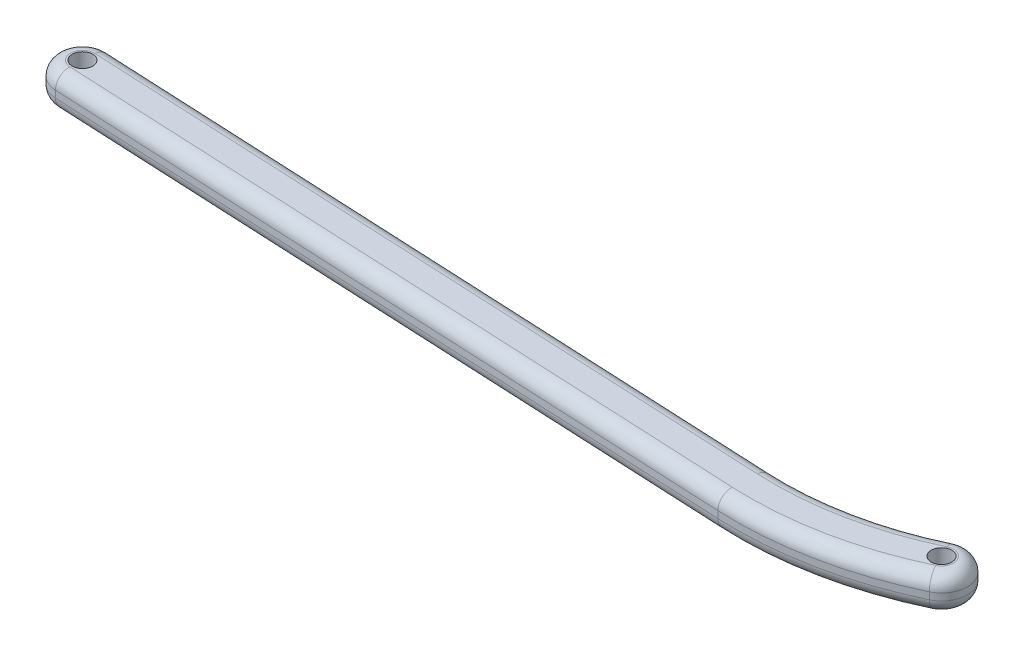
from build123d import *

# Parameters (mm, degrees)
CROQUIS1_R              = 3
SALIENTE_EXTRUIR1_DEPTH = 5
REDONDEO7_R             = 4


with BuildPart() as part:
    # Croquis1 → Saliente-Extruir1 (new, symmetric)
    with BuildSketch(Plane(origin=(0, 0, 0), x_dir=(-1, 0, 0), z_dir=(0, 1, 0))):
        with BuildLine():
            Line((48.02345169, 17.068699579), (250.354605919, 7.491612286))
            ThreePointArc((250.354605919, 7.491612286), (257.491612286, -0.354605919), (249.645394081, -7.491612286))
            Line((249.645394081, -7.491612286), (47.314239852, 2.085475008))
            ThreePointArc((47.314239852, 2.085475008), (24.720790116, 0.376753137), (3.220557514, -6.773330739))
            ThreePointArc((3.220557514, -6.773330739), (-6.773330739, -3.220557514), (-3.220557514, 6.773330739))
            ThreePointArc((-3.220557514, 6.773330739), (21.766199294, 15.082887676), (48.02345169, 17.068699579))
        make_face()
        with Locations(Location((0, 0, 0), (0, 0, 90))):
            Circle(CROQUIS1_R, mode=Mode.SUBTRACT)
        with Locations(Location((250, 0, 0), (0, 0, 90))):
            Circle(CROQUIS1_R, mode=Mode.SUBTRACT)
    extrude(amount=SALIENTE_EXTRUIR1_DEPTH, both=True)

    # Redondeo7
    redondeo7_edges = [part.edges().sort_by_distance(p)[0] for p in [
        (-148.479816967, 5, -2.703068639),
        (-257.491612286, 5, -0.354605919),
        (-149.189028804, 5, 12.280155933),
        (-21.766199294, 5, 15.082887676),
        (6.773330739, 5, -3.220557514),
        (-21.766199294, -5, 15.082887676),
        (-149.189028804, -5, 12.280155933),
        (-257.491612286, -5, -0.354605919),
        (-148.479816967, -5, -2.703068639),
        (-24.720790116, -5, 0.376753137),
        (6.773330739, -5, -3.220557514),
        (-24.720790116, 5, 0.376753137),
    ]]
    fillet(redondeo7_edges, radius=REDONDEO7_R)


solid = part.part
